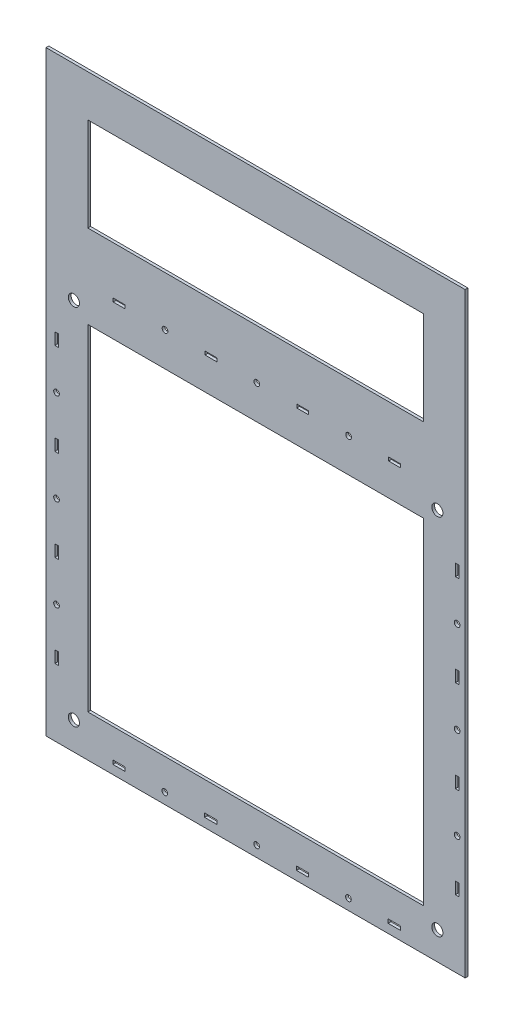
from build123d import *

# Parameters (mm, degrees)
SKETCH_1_R      = 2.05
SKETCH_1_R_2    = 4
SKETCH_1_W      = 8.8
SKETCH_1_H      = 2.8
SKETCH_1_W_2    = 2.5
SKETCH_1_H_2    = 8.5
SKETCH_1_W_3    = 8.5
SKETCH_1_H_3    = 2.5
SKETCH_1_W_4    = 241.301375666
SKETCH_1_H_4    = 241.301375666
SKETCH_1_H_5    = 67.3
EXTRUDE_1_DEPTH = 2


with BuildPart() as part:
    # 草图1 → 凸台-拉伸1 (new body)
    with BuildSketch(Plane.XY):
        Polygon((150.650687833, -150.650687833), (-150.650687833, -150.650687833), (-150.650687833, 150.650687833), (-150.650687833, 277.950687833), (150.650687833, 277.950687833), (150.650687833, 150.650687833), align=None)
        with Locations((0.724285714, -142.895)):
            Circle(SKETCH_1_R, mode=Mode.SUBTRACT)
        with Locations((66.724285714, -142.895)):
            Circle(SKETCH_1_R, mode=Mode.SUBTRACT)
        with Locations(Location((-65.275714286, -142.895, 0), (0, 0, 180))):
            Circle(SKETCH_1_R, mode=Mode.SUBTRACT)
        with Locations(Location((-143.125714286, 66.955, 0), (0, 0, 180))):
            Circle(SKETCH_1_R, mode=Mode.SUBTRACT)
        with Locations((-143.125714286, 0.955)):
            Circle(SKETCH_1_R, mode=Mode.SUBTRACT)
        with Locations((-143.125714286, -65.045)):
            Circle(SKETCH_1_R, mode=Mode.SUBTRACT)
        with Locations(Location((66.874285714, 144.955, 0), (0, 0, 180))):
            Circle(SKETCH_1_R, mode=Mode.SUBTRACT)
        with Locations((0.874285714, 144.955)):
            Circle(SKETCH_1_R, mode=Mode.SUBTRACT)
        with Locations((-65.125714286, 144.955)):
            Circle(SKETCH_1_R, mode=Mode.SUBTRACT)
        with Locations(Location((144.874285714, -65.045, 0), (0, 0, 180))):
            Circle(SKETCH_1_R, mode=Mode.SUBTRACT)
        with Locations((144.874285714, 0.955)):
            Circle(SKETCH_1_R, mode=Mode.SUBTRACT)
        with Locations((144.874285714, 66.955)):
            Circle(SKETCH_1_R, mode=Mode.SUBTRACT)
        with Locations((-130.650687833, -130.650687833)):
            Circle(SKETCH_1_R_2, mode=Mode.SUBTRACT)
        with Locations((-130.650687833, 130.650687833)):
            Circle(SKETCH_1_R_2, mode=Mode.SUBTRACT)
        with Locations((130.650687833, 130.650687833)):
            Circle(SKETCH_1_R_2, mode=Mode.SUBTRACT)
        with Locations((130.650687833, -130.650687833)):
            Circle(SKETCH_1_R_2, mode=Mode.SUBTRACT)
        with Locations((99.724285714, -142.895)):
            Rectangle(SKETCH_1_W, SKETCH_1_H, mode=Mode.SUBTRACT)
        with Locations((33.724285714, -142.895)):
            Rectangle(SKETCH_1_W, SKETCH_1_H, mode=Mode.SUBTRACT)
        with Locations((-32.275714286, -142.895)):
            Rectangle(SKETCH_1_W, SKETCH_1_H, mode=Mode.SUBTRACT)
        with Locations((-98.275714286, -142.895)):
            Rectangle(SKETCH_1_W, SKETCH_1_H, mode=Mode.SUBTRACT)
        with Locations((-143.125714286, 99.955)):
            Rectangle(SKETCH_1_W_2, SKETCH_1_H_2, mode=Mode.SUBTRACT)
        with Locations((-143.125714286, 33.955)):
            Rectangle(SKETCH_1_W_2, SKETCH_1_H_2, mode=Mode.SUBTRACT)
        with Locations((-143.125714286, -32.045)):
            Rectangle(SKETCH_1_W_2, SKETCH_1_H_2, mode=Mode.SUBTRACT)
        with Locations((-143.125714286, -98.045)):
            Rectangle(SKETCH_1_W_2, SKETCH_1_H_2, mode=Mode.SUBTRACT)
        with Locations((99.874285714, 144.955)):
            Rectangle(SKETCH_1_W_3, SKETCH_1_H_3, mode=Mode.SUBTRACT)
        with Locations((33.874285714, 144.955)):
            Rectangle(SKETCH_1_W_3, SKETCH_1_H_3, mode=Mode.SUBTRACT)
        with Locations((-32.125714286, 144.955)):
            Rectangle(SKETCH_1_W_3, SKETCH_1_H_3, mode=Mode.SUBTRACT)
        with Locations((-98.125714286, 144.955)):
            Rectangle(SKETCH_1_W_3, SKETCH_1_H_3, mode=Mode.SUBTRACT)
        with Locations((144.874285714, -98.045)):
            Rectangle(SKETCH_1_W_2, SKETCH_1_H_2, mode=Mode.SUBTRACT)
        with Locations((144.874285714, -32.045)):
            Rectangle(SKETCH_1_W_2, SKETCH_1_H_2, mode=Mode.SUBTRACT)
        with Locations((144.874285714, 33.955)):
            Rectangle(SKETCH_1_W_2, SKETCH_1_H_2, mode=Mode.SUBTRACT)
        with Locations((144.874285714, 99.955)):
            Rectangle(SKETCH_1_W_2, SKETCH_1_H_2, mode=Mode.SUBTRACT)
        Rectangle(SKETCH_1_W_4, SKETCH_1_H_4, mode=Mode.SUBTRACT)
        with Locations((0, 214.300687833)):
            Rectangle(SKETCH_1_W_4, SKETCH_1_H_5, mode=Mode.SUBTRACT)
    extrude(amount=EXTRUDE_1_DEPTH)


solid = part.part
